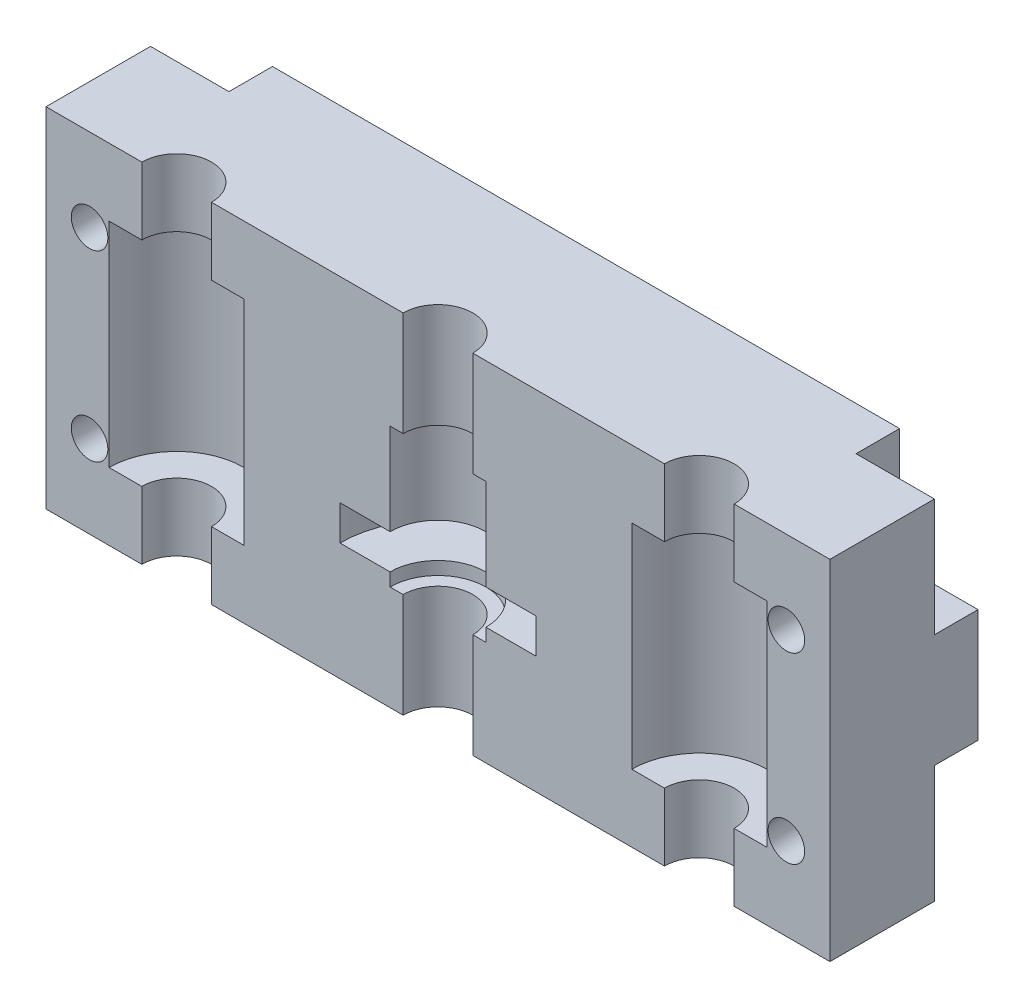
from build123d import *

# Parameters (mm, degrees)
ESQUISSE1_W             = 90
ESQUISSE1_H             = 40
BOSS_EXTRU_1_DEPTH      = 12
ESQUISSE2_R             = 4
ENL_V_MAT_EXTRU_1_DEPTH = 62.392181913
ESQUISSE3_R             = 7.75
ENL_V_MAT_EXTRU_2_DEPTH = 12.25
ESQUISSE9_W             = 50
ESQUISSE9_H             = 14.72812859
ESQUISSE9_H_2           = 10.600161614
ENL_V_MAT_EXTRU_7_DEPTH = 31
BOSS_EXTRUDE1_DEPTH     = 5
SKETCH2_R               = 2.1
CUT_EXTRUDE1_DEPTH      = 53.096065111
SKETCH3_R               = 4
CUT_EXTRUDE2_DEPTH      = 10
CUT_EXTRUDE3_DEPTH      = 5
SKETCH6_W               = 4
SKETCH6_H               = 31
BOSS_EXTRUDE2_START     = 4.5
BOSS_EXTRUDE2_DEPTH     = 4.5
BOSS_EXTRUDE3_DEPTH     = 4.5


with BuildPart() as part:
    # Esquisse1 → Boss.-Extru.1 (new body)
    with BuildSketch(Plane.XY):
        Rectangle(ESQUISSE1_W, ESQUISSE1_H)
    extrude(amount=BOSS_EXTRU_1_DEPTH)

    # Esquisse2 → Enlèv. mat.-Extru.1 (cut, through all)
    with BuildSketch(Plane(origin=(0, 20, 0), x_dir=(1, 0, 0), z_dir=(0, 1, 0))):
        with Locations((-30, -12)):
            Circle(ESQUISSE2_R)
        with Locations((30, -12)):
            Circle(ESQUISSE2_R)
    extrude(amount=-ENL_V_MAT_EXTRU_1_DEPTH, mode=Mode.SUBTRACT)

    # Esquisse3 → Enlèv. mat.-Extru.2 (cut, symmetric)
    with BuildSketch(Plane(origin=(0, 0, 0), x_dir=(1, 0, 0), z_dir=(0, 1, 0))):
        with Locations((-30, -12)):
            Circle(ESQUISSE3_R)
    enl_v_mat_extru_2 = extrude(amount=ENL_V_MAT_EXTRU_2_DEPTH, both=True, mode=Mode.SUBTRACT)

    # Esquisse9 → Enlèv. mat.-Extru.7 (cut)
    with BuildSketch(Plane.XY.offset(12)):
        with Locations((0, -22.864064295)):
            Rectangle(ESQUISSE9_W, ESQUISSE9_H)
        with Locations((0, 20.800080807)):
            Rectangle(ESQUISSE9_W, ESQUISSE9_H_2)
    extrude(amount=-ENL_V_MAT_EXTRU_7_DEPTH, mode=Mode.SUBTRACT)

    # Sketch1 → Boss-Extrude1 (add)
    with BuildSketch(Plane(origin=(0, 0, 0), x_dir=(-1, 0, 0), z_dir=(0, 0, -1))):
        Polygon((-25, -15.5), (25, -15.5), (25, -20), (45, -20), (45, 20), (25, 20), (25, 15.5), (-25, 15.5), (-25, 20), (-45, 20), (-45, -20), (-25, -20), align=None)
    extrude(amount=BOSS_EXTRUDE1_DEPTH)

    # Sketch2 → Cut-Extrude1 (cut, through all)
    with BuildSketch(Plane.XY.offset(12)):
        with Locations((-40, 10.5)):
            Circle(SKETCH2_R)
        with Locations((40, 10.5)):
            Circle(SKETCH2_R)
        with Locations((40, -10.5)):
            Circle(SKETCH2_R)
        with Locations((-40, -10.5)):
            Circle(SKETCH2_R)
    extrude(amount=-CUT_EXTRUDE1_DEPTH, mode=Mode.SUBTRACT)

    # Sketch3 → Cut-Extrude2 (cut)
    with BuildSketch(Plane(origin=(0, 0, -5), x_dir=(-1, 0, 0), z_dir=(0, 0, -1))):
        with Locations((-40, 10.5)):
            Circle(SKETCH3_R)
        with Locations((40, 10.5)):
            Circle(SKETCH3_R)
        with Locations((40, -10.5)):
            Circle(SKETCH3_R)
        with Locations((-40, -10.5)):
            Circle(SKETCH3_R)
    extrude(amount=-CUT_EXTRUDE2_DEPTH, mode=Mode.SUBTRACT)

    # Sketch4 → Cut-Extrude3 (cut)
    with BuildSketch(Plane(origin=(0, 0, -5), x_dir=(-1, 0, 0), z_dir=(0, 0, -1))):
        with BuildLine():
            Line((-36, 10.5), (-36, 20))
            Line((-36, 20), (-45, 20))
            Line((-45, 20), (-45, 6.5))
            Line((-45, 6.5), (-40, 6.5))
            ThreePointArc((-40, 6.5), (-42.828427125, 13.328427125), (-36, 10.5))
        make_face()
        with BuildLine():
            Line((-40, -6.5), (-50, -6.5))
            Line((-50, -6.5), (-45, -20))
            Line((-45, -20), (-36, -20))
            Line((-36, -20), (-36, -10.5))
            ThreePointArc((-36, -10.5), (-42.828427125, -13.328427125), (-40, -6.5))
        make_face()
        with BuildLine():
            Line((45, -20), (45, -6.5))
            Line((45, -6.5), (40, -6.5))
            ThreePointArc((40, -6.5), (42.828427125, -13.328427125), (36, -10.5))
            Line((36, -10.5), (36, -20))
            Line((36, -20), (45, -20))
        make_face()
        with BuildLine():
            Line((40, 6.5), (45, 6.5))
            Line((45, 6.5), (45, 20))
            Line((45, 20), (36, 20))
            Line((36, 20), (36, 10.5))
            ThreePointArc((36, 10.5), (42.828427125, 13.328427125), (40, 6.5))
        make_face()
    extrude(amount=-CUT_EXTRUDE3_DEPTH, mode=Mode.SUBTRACT)

    # Mirror1: Enlèv. mat.-Extru.2 across plane
    add(enl_v_mat_extru_2.mirror(Plane.ZY), mode=Mode.SUBTRACT)

    # Sketch6 → Cut-Revolve1 (revolve, cut)
    with BuildSketch(Plane.XY.offset(12)):
        with Locations((-2, 0)):
            Rectangle(SKETCH6_W, SKETCH6_H)
    revolve(axis=Axis((0, -15.5, 12), (0, 1, 0)), mode=Mode.SUBTRACT)

    # Sketch7 → Cut-Revolve4 (revolve, cut)
    with BuildSketch(Plane.XY.offset(12)):
        Polygon((-11.25, -2.5), (-11.25, -6.5), (-5.5, -6.5), (-5.5, -8), (-4, -8), (-4, 8), (-5.5, 8), (-5.5, -2.5), align=None)
    revolve(axis=Axis((0, 8, 12), (0, -1, 0)), mode=Mode.SUBTRACT)

    # Sketch8 → Boss-Extrude2 (add)
    with BuildSketch(Plane(origin=(0, 15.5, 0), x_dir=(1, 0, 0), z_dir=(0, 1, 0)).offset(BOSS_EXTRUDE2_START)):
        with BuildLine():
            Line((4, -12), (25, -12))
            Line((25, -12), (25, 5))
            Line((25, 5), (-25, 5))
            Line((-25, 5), (-25, -12))
            Line((-25, -12), (-4, -12))
            ThreePointArc((-4, -12), (0, -8), (4, -12))
        make_face()
    extrude(amount=-BOSS_EXTRUDE2_DEPTH)

    # Sketch9 → Boss-Extrude3 (add)
    with BuildSketch(Plane.XZ.offset(15.5)):
        with BuildLine():
            Line((-4, 12), (-25, 12))
            Line((-25, 12), (-25, -5))
            Line((-25, -5), (25, -5))
            Line((25, -5), (25, 12))
            Line((25, 12), (4, 12))
            ThreePointArc((4, 12), (0, 8), (-4, 12))
        make_face()
    extrude(amount=BOSS_EXTRUDE3_DEPTH)


solid = part.part
